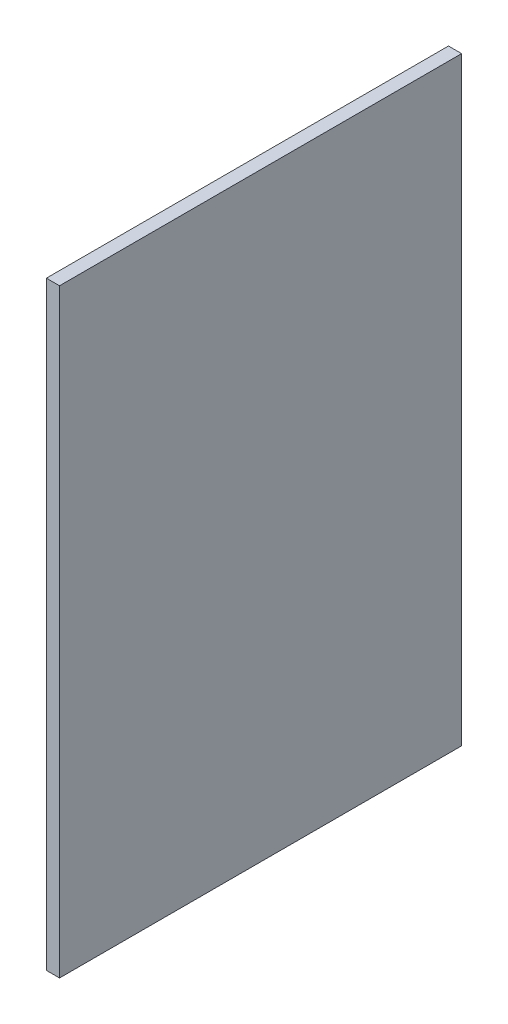
from build123d import *

# Parameters (mm, degrees)
SKETCH1_W           = 550
SKETCH1_H           = 820
BOSS_EXTRUDE1_DEPTH = 18


with BuildPart() as part:
    # Sketch1 → Boss-Extrude1 (new body)
    with BuildSketch(Plane(origin=(0, 0, 0), x_dir=(0, 0, -1), z_dir=(1, 0, 0))):
        Rectangle(SKETCH1_W, SKETCH1_H)
    extrude(amount=BOSS_EXTRUDE1_DEPTH)


solid = part.part
